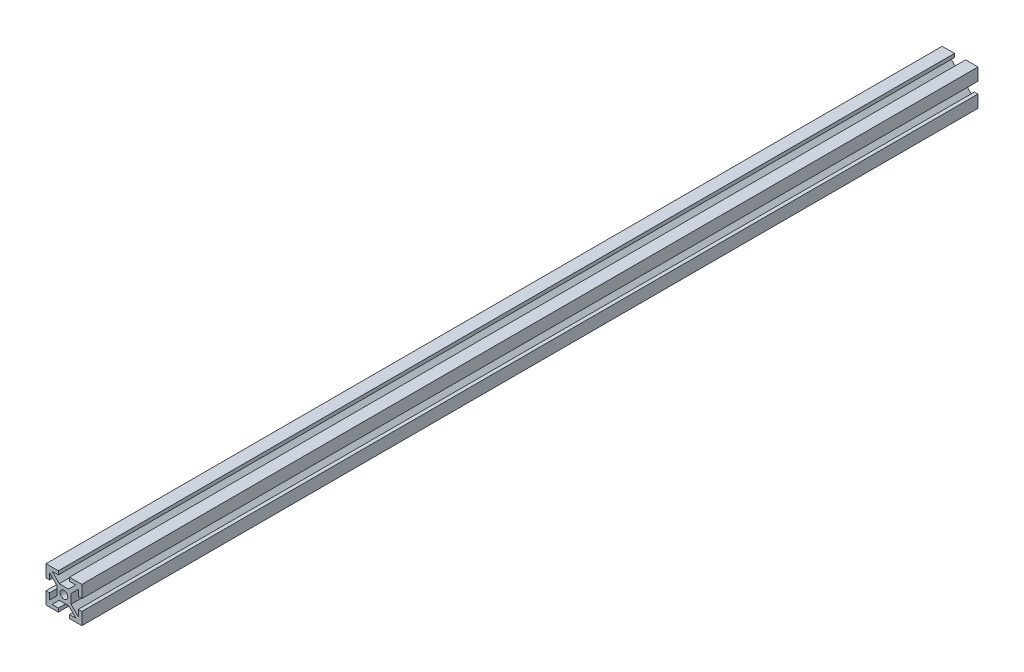
from build123d import *

# Parameters (mm, degrees)
ESQUISSE1_R        = 2.15
BOSS_EXTRU_1_DEPTH = 500


with BuildPart() as part:
    # Esquisse1 → Boss.-Extru.1 (new body)
    with BuildSketch(Plane.XY):
        Polygon((20, 13.1), (18, 13.1), (18, 16.585786438), (14, 12.585786438), (14, 10), (14, 7.414213562), (18, 3.414213562), (18, 6.9), (20, 6.9), (20, 0), (13.1, 0), (13.1, 2), (16.585786438, 2), (12.585786438, 6), (10, 6), (7.414213562, 6), (3.414213562, 2), (6.9, 2), (6.9, 0), (0, 0), (0, 6.9), (2, 6.9), (2, 3.414213562), (6, 7.414213562), (6, 10), (6, 12.585786438), (2, 16.585786438), (2, 13.1), (0, 13.1), (0, 20), (6.9, 20), (6.9, 18), (3.414213562, 18), (7.414213562, 14), (10, 14), (12.585786438, 14), (16.585786438, 18), (13.1, 18), (13.1, 20), (20, 20), align=None)
        with Locations((10, 10)):
            Circle(ESQUISSE1_R, mode=Mode.SUBTRACT)
    extrude(amount=BOSS_EXTRU_1_DEPTH)


solid = part.part
